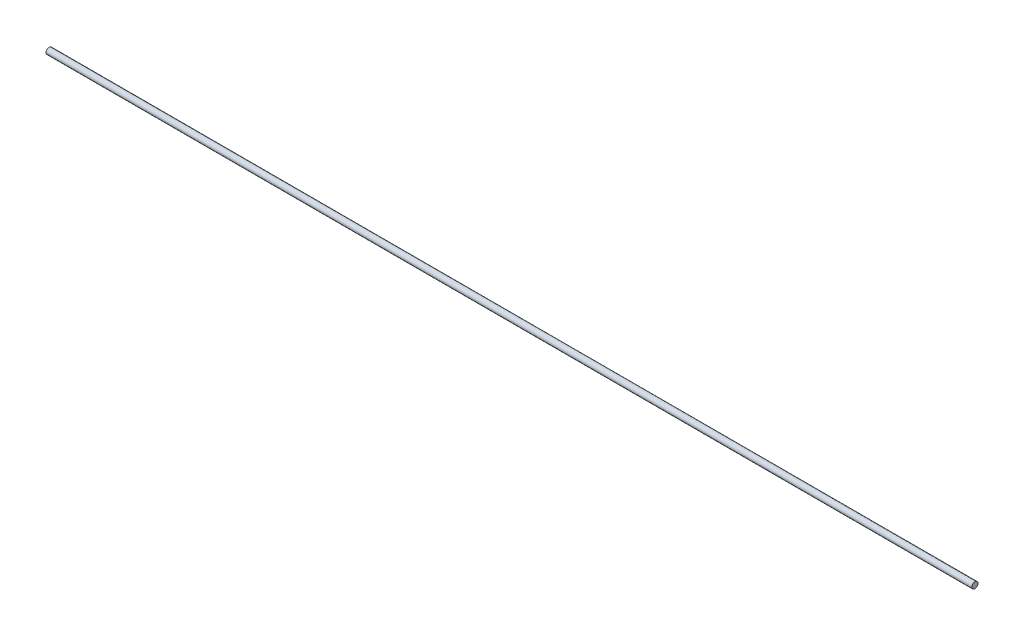
from build123d import *

# Parameters (mm, degrees)
SKETCH1_R           = 0.5
BOSS_EXTRUDE1_DEPTH = 150


with BuildPart() as part:
    # Sketch1 → Boss-Extrude1 (new body)
    with BuildSketch(Plane(origin=(0, 0, 0), x_dir=(0, 0, -1), z_dir=(1, 0, 0))):
        Circle(SKETCH1_R)
    extrude(amount=BOSS_EXTRUDE1_DEPTH)


solid = part.part
